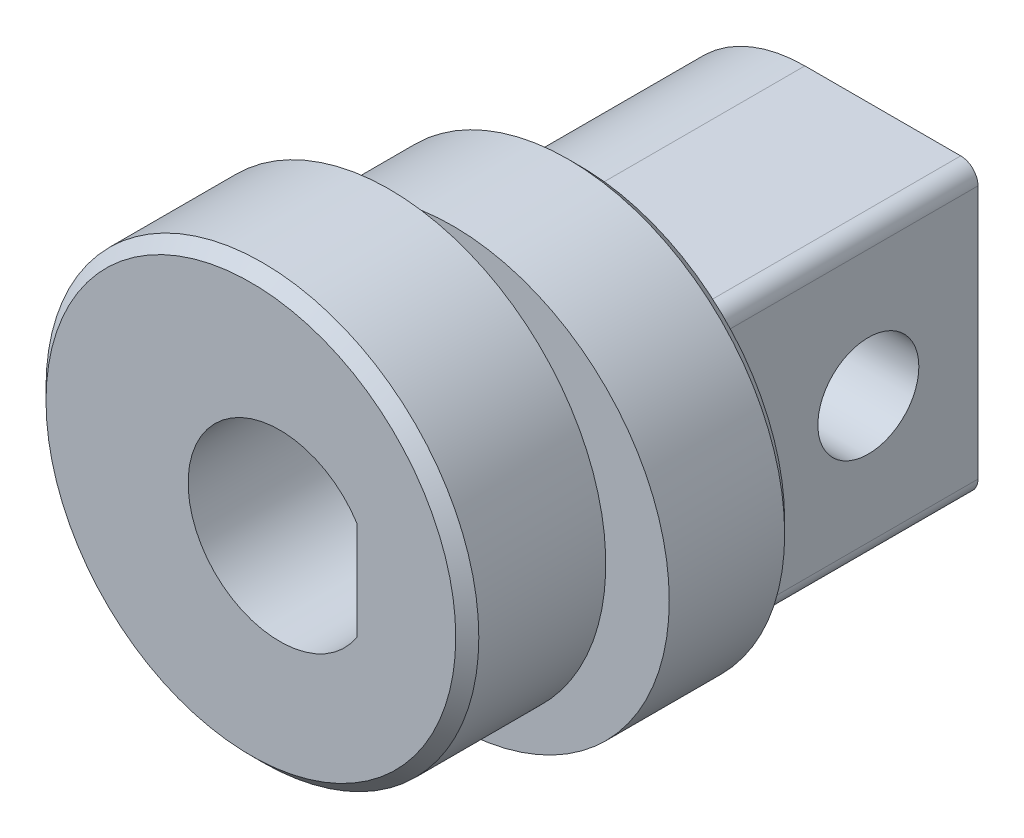
from build123d import *

# Parameters (mm, degrees)
BOSS_EXTRUDE4_DEPTH            = 4.2
BOSS_EXTRUDE4_DEPTH_BACK       = 0.2
SKETCH10_R                     = 7.5
BOSS_EXTRUDE5_DEPTH            = 9
SKETCH16_R                     = 7.5
BOSS_EXTRUDE6_DEPTH            = 4.8
CUT_EXTRUDE2_DEPTH             = 22.52161704
F_3_5_3_5_DIAMETER_HOLE0_D     = 3.5
F_3_5_3_5_DIAMETER_HOLE0_DEPTH = 4
F_3_5_3_5_DIAMETER_HOLE0_TIP   = 1.051506083
CHAMFER2_SIZE                  = 0.4


with BuildPart() as part:
    # Sketch10 → Boss-Extrude4 (new, two sides: drawn at the far end of the back side and taken through both)
    with BuildSketch(Plane.XY.offset(0.4).offset(-BOSS_EXTRUDE4_DEPTH_BACK)):
        with Locations((1.2, 0)):
            Circle(SKETCH10_R)
    extrude(amount=BOSS_EXTRUDE4_DEPTH + BOSS_EXTRUDE4_DEPTH_BACK)

    # Sketch11 → Boss-Extrude5 (add)
    with BuildSketch(Plane(origin=(0, 0, 0.2), x_dir=(-1, 0, 0), z_dir=(0, 0, -1))):
        with BuildLine():
            Line((-6, -4.4), (-6, 4.4))
            ThreePointArc((-6, 4.4), (-5.824264069, 4.824264069), (-5.4, 5))
            Line((-5.4, 5), (0, 5))
            ThreePointArc((0, 5), (5, 0), (0, -5))
            Line((0, -5), (-5.4, -5))
            ThreePointArc((-5.4, -5), (-5.824264069, -4.824264069), (-6, -4.4))
        make_face()
    extrude(amount=BOSS_EXTRUDE5_DEPTH)

    # Sketch16 → Boss-Extrude6 (add)
    with BuildSketch(Plane(origin=(0, 0, 4.6), x_dir=(-1, 0, 0), z_dir=(0, 0, -1))):
        with Locations((1, 0)):
            Circle(SKETCH16_R)
    extrude(amount=-BOSS_EXTRUDE6_DEPTH)

    # Sketch17 → Cut-Extrude2 (cut, through all)
    with BuildSketch(Plane.XY.offset(9.4)):
        with BuildLine():
            Line((2.675, -1.710263138), (2.675, 1.710263138))
            ThreePointArc((2.675, 1.710263138), (-3.175, 0), (2.675, -1.710263138))
        make_face()
    extrude(amount=-CUT_EXTRUDE2_DEPTH, mode=Mode.SUBTRACT)

    # Ø3.5 (3.5) Diameter Hole0
    with Locations(Plane(origin=(6, 0, 0), x_dir=(0, 0, -1), z_dir=(1, 0, 0))):
        with Locations((5, 0)):
            Hole(F_3_5_3_5_DIAMETER_HOLE0_D / 2, depth=F_3_5_3_5_DIAMETER_HOLE0_DEPTH)
            with Locations((0, 0, -(F_3_5_3_5_DIAMETER_HOLE0_DEPTH + F_3_5_3_5_DIAMETER_HOLE0_TIP / 2))):  # 118° drill point
                Cone(0, F_3_5_3_5_DIAMETER_HOLE0_D / 2, F_3_5_3_5_DIAMETER_HOLE0_TIP, mode=Mode.SUBTRACT)

    # Chamfer2
    chamfer2_edges = [part.edges().sort_by_distance(p)[0] for p in [
        (6.5, 0, 9.4),
        (-6.3, 0, 0.2),
    ]]
    chamfer(chamfer2_edges, length=CHAMFER2_SIZE)


solid = part.part
